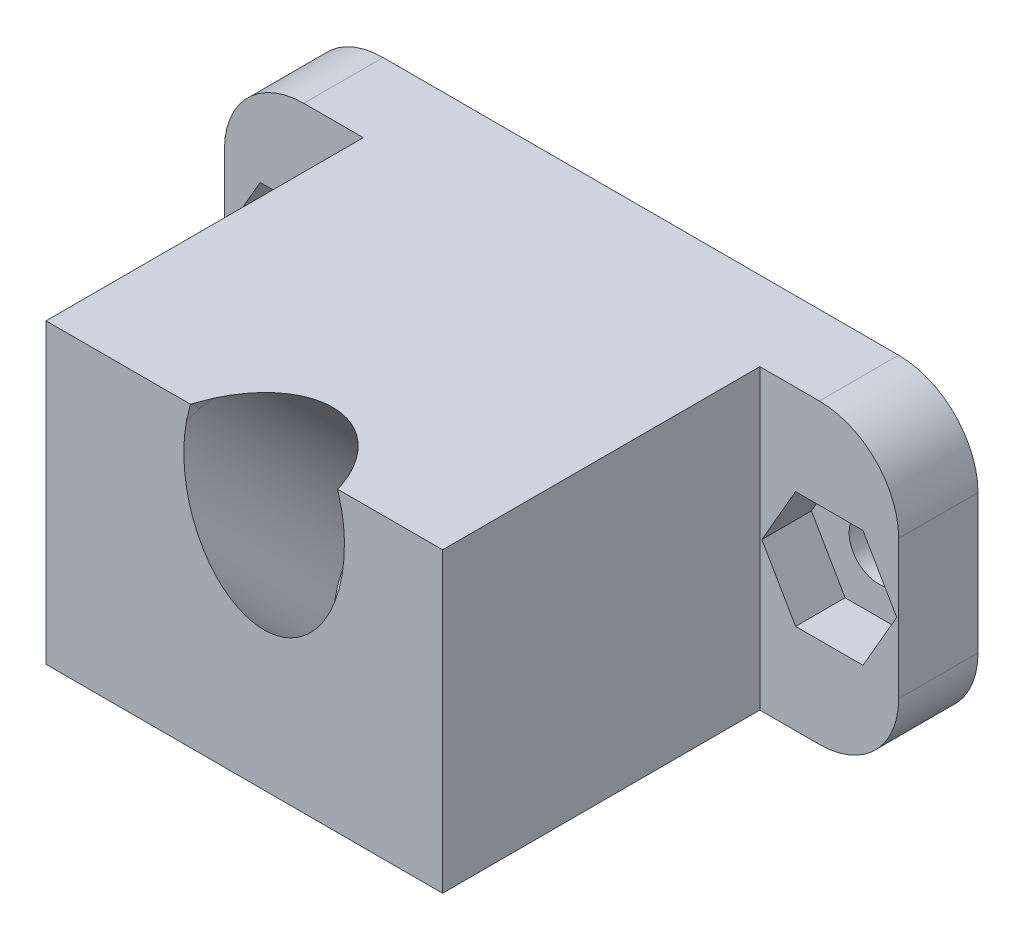
from build123d import *

# Parameters (mm, degrees)
SKETCH_1_W          = 20
SKETCH_1_H          = 15
EXTRUDE_1_DEPTH     = 20
SKETCH_2_W          = 7
SKETCH_2_H          = 15
EXTRUDE_6_DEPTH     = 4
EXTRUDE_7_DEPTH     = 1.5
SKETCH_10_R         = 1.5
CUT_EXTRUDE_4_DEPTH = 1.5
FILLET_1_R          = 4
SKETCH_11_R         = 4.05
CUT_EXTRUDE_5_DEPTH = 13
CUT_EXTRUDE_6_DEPTH = 10


with BuildPart() as part:
    # 草图1 → 凸台-拉伸1 (new body)
    with BuildSketch(Plane.XY):
        Rectangle(SKETCH_1_W, SKETCH_1_H)
    extrude(amount=EXTRUDE_1_DEPTH)

    # 草图2 → 凸台-拉伸6 (add)
    # profile 1 of 2: a face of its own
    with BuildSketch(Plane.XY):
        with Locations((-13.5, 0)):
            Rectangle(SKETCH_2_W, SKETCH_2_H)
        Polygon((-10.1, 0), (-11.8, 2.944486373), (-15.2, 2.944486373), (-16.9, 0), (-15.2, -2.944486373), (-11.8, -2.944486373), align=None, mode=Mode.SUBTRACT)
    # profile 2 of 2: a face of its own
    with BuildSketch(Plane.XY):
        with Locations((13.5, 0)):
            Rectangle(SKETCH_2_W, SKETCH_2_H)
        Polygon((16.9, 0), (15.2, 2.944486373), (11.8, 2.944486373), (10.1, 0), (11.8, -2.944486373), (15.2, -2.944486373), align=None, mode=Mode.SUBTRACT)
    extrude(amount=EXTRUDE_6_DEPTH)

    # 草图9 → 凸台-拉伸7 (add)
    with BuildSketch(Plane(origin=(0, 0, 0), x_dir=(-1, 0, 0), z_dir=(0, 0, -1))):
        Polygon((-10.1, 0), (-11.8, 2.944486373), (-15.2, 2.944486373), (-16.9, 0), (-15.2, -2.944486373), (-11.8, -2.944486373), align=None)
        Polygon((16.9, 0), (15.2, 2.944486373), (11.8, 2.944486373), (10.1, 0), (11.8, -2.944486373), (15.2, -2.944486373), align=None)
    extrude(amount=-EXTRUDE_7_DEPTH)

    # 草图10 → 切除-拉伸4 (cut)
    with BuildSketch(Plane(origin=(0, 0, 0), x_dir=(-1, 0, 0), z_dir=(0, 0, -1))):
        with Locations((-13.5, 0)):
            Circle(SKETCH_10_R)
        with Locations((13.5, 0)):
            Circle(SKETCH_10_R)
    extrude(amount=-CUT_EXTRUDE_4_DEPTH, mode=Mode.SUBTRACT)

    # 圆角1
    fillet_1_edges = [part.edges().sort_by_distance(p)[0] for p in [
        (-17, 7.5, 2),
        (-17, -7.5, 2),
        (17, -7.5, 2),
        (17, 7.5, 2),
    ]]
    fillet(fillet_1_edges, radius=FILLET_1_R)

    # 草图11 → 切除-拉伸5 (cut)
    with BuildSketch(Plane(origin=(0, 13.321067812, 13.321067812), x_dir=(1, 0, 0), z_dir=(0, 0.7071067811865389, 0.7071067811865561))):
        with Locations(Location((1, -10.445436483, 0), (0, 0, 270))):
            Circle(SKETCH_11_R)
    extrude(amount=-CUT_EXTRUDE_5_DEPTH, mode=Mode.SUBTRACT)

    # 草图12 → 切除-拉伸6 (cut)
    with BuildSketch(Plane(origin=(0, 13.321067812, 13.321067812), x_dir=(1, 0, 0), z_dir=(0, -0.7071067811865389, -0.7071067811865562))):
        Polygon((4.391788695, 8.232233047), (-2.391788695, 8.232233047), (-2.708147576, 8.816896782), (-2.924601891, 9.445436483), (4.924601891, 9.445436483), (4.643673318, 8.677345775), align=None)
    extrude(amount=-CUT_EXTRUDE_6_DEPTH, mode=Mode.SUBTRACT)


solid = part.part
